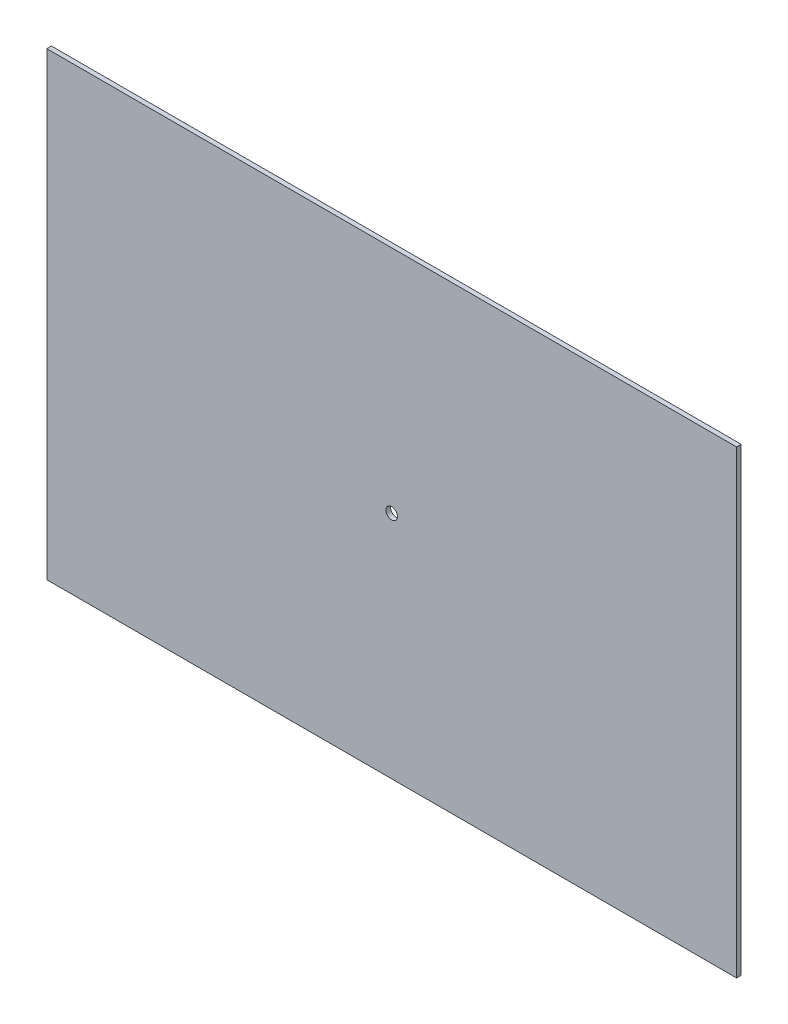
from build123d import *

# Parameters (mm, degrees)
SKETCH_1_W          = 300
SKETCH_1_H          = 200
EXTRUDE_345_DEPTH   = 2
SKETCH_2_R          = 2.5
CUT_EXTRUDE_1_DEPTH = 181.288657436


with BuildPart() as part:
    # Эскиз1 → Extrude 345 (new body)
    with BuildSketch(Plane.XY):
        Rectangle(SKETCH_1_W, SKETCH_1_H)
    extrude(amount=EXTRUDE_345_DEPTH)

    # Эскиз2 → Вырез-Вытянуть1 (cut, through all)
    with BuildSketch(Plane.XY.offset(2)):
        Circle(SKETCH_2_R)
    extrude(amount=-CUT_EXTRUDE_1_DEPTH, mode=Mode.SUBTRACT)


solid = part.part
